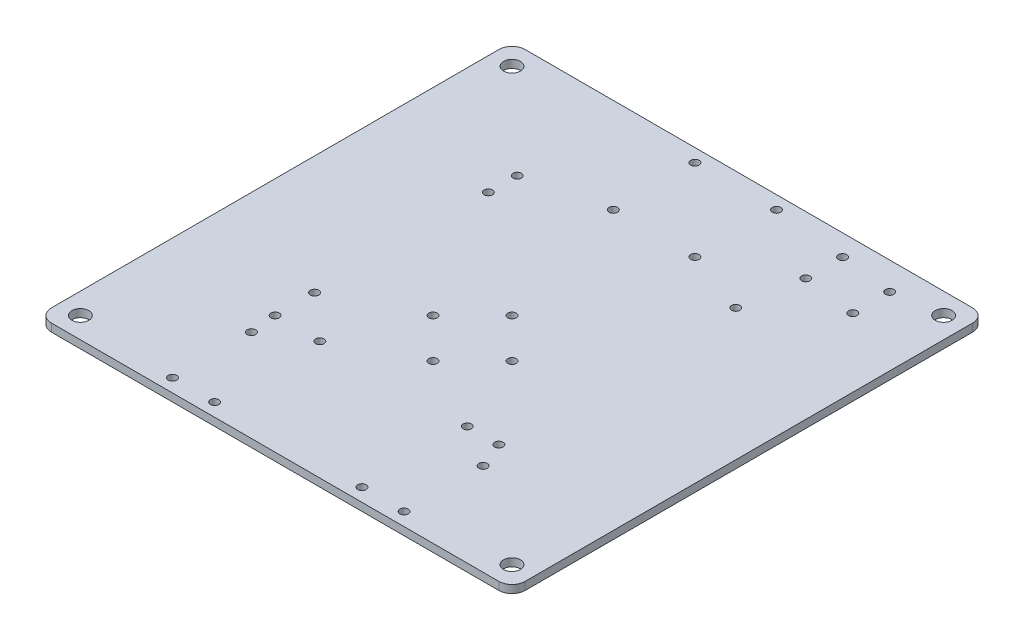
from build123d import *

# Parameters (mm, degrees)
SKETCH_1_R      = 3.2
SKETCH_1_R_2    = 1.6
EXTRUDE_1_DEPTH = 3


with BuildPart() as part:
    # 草图1 → 凸台-拉伸1 (new body)
    with BuildSketch(Plane(origin=(0, 0, 0), x_dir=(1, 0, 0), z_dir=(0, 1, 0))):
        with BuildLine():
            Line((5, 0), (175, 0))
            ThreePointArc((175, 0), (178.535533906, 1.464466094), (180, 5))
            Line((180, 5), (180, 175))
            ThreePointArc((180, 175), (178.535533906, 178.535533906), (175, 180))
            Line((175, 180), (5, 180))
            ThreePointArc((5, 180), (1.464466094, 178.535533906), (0, 175))
            Line((0, 175), (0, 5))
            ThreePointArc((0, 5), (1.464466094, 1.464466094), (5, 0))
        make_face()
        with Locations(Location((8, 172, 0), (0, 0, 270))):
            Circle(SKETCH_1_R, mode=Mode.SUBTRACT)
        with Locations(Location((172, 172, 0), (0, 0, 270))):
            Circle(SKETCH_1_R, mode=Mode.SUBTRACT)
        with Locations(Location((8, 8, 0), (0, 0, 270))):
            Circle(SKETCH_1_R, mode=Mode.SUBTRACT)
        with Locations(Location((172, 8, 0), (0, 0, 270))):
            Circle(SKETCH_1_R, mode=Mode.SUBTRACT)
        with Locations(Location((74.5, 175, 0), (0, 0, 270))):
            Circle(SKETCH_1_R_2, mode=Mode.SUBTRACT)
        with Locations(Location((74.5, 144, 0), (0, 0, 270))):
            Circle(SKETCH_1_R_2, mode=Mode.SUBTRACT)
        with Locations(Location((105.5, 144, 0), (0, 0, 90))):
            Circle(SKETCH_1_R_2, mode=Mode.SUBTRACT)
        with Locations(Location((105.5, 175, 0), (0, 0, 90))):
            Circle(SKETCH_1_R_2, mode=Mode.SUBTRACT)
        with Locations(Location((133.6, 172, 0), (0, 0, 270))):
            Circle(SKETCH_1_R_2, mode=Mode.SUBTRACT)
        with Locations(Location((133.6, 158, 0), (0, 0, 270))):
            Circle(SKETCH_1_R_2, mode=Mode.SUBTRACT)
        with Locations(Location((154, 169.5, 0), (0, 0, 270))):
            Circle(SKETCH_1_R_2, mode=Mode.SUBTRACT)
        with Locations(Location((154, 155.5, 0), (0, 0, 270))):
            Circle(SKETCH_1_R_2, mode=Mode.SUBTRACT)
        with Locations(Location((130, 135, 0), (0, 0, 270))):
            Circle(SKETCH_1_R_2, mode=Mode.SUBTRACT)
        with Locations(Location((130, 45, 0), (0, 0, 270))):
            Circle(SKETCH_1_R_2, mode=Mode.SUBTRACT)
        with Locations(Location((45, 137, 0), (0, 0, 270))):
            Circle(SKETCH_1_R_2, mode=Mode.SUBTRACT)
        with Locations(Location((45, 45, 0), (0, 0, 270))):
            Circle(SKETCH_1_R_2, mode=Mode.SUBTRACT)
        with Locations(Location((45, 126, 0), (0, 0, 270))):
            Circle(SKETCH_1_R_2, mode=Mode.SUBTRACT)
        with Locations(Location((45, 60, 0), (0, 0, 270))):
            Circle(SKETCH_1_R_2, mode=Mode.SUBTRACT)
        with Locations(Location((62, 45, 0), (0, 0, 270))):
            Circle(SKETCH_1_R_2, mode=Mode.SUBTRACT)
        with Locations(Location((62, 5, 0), (0, 0, 270))):
            Circle(SKETCH_1_R_2, mode=Mode.SUBTRACT)
        with Locations(Location((118, 45, 0), (0, 0, 270))):
            Circle(SKETCH_1_R_2, mode=Mode.SUBTRACT)
        with Locations(Location((118, 5, 0), (0, 0, 270))):
            Circle(SKETCH_1_R_2, mode=Mode.SUBTRACT)
        with Locations(Location((90, 90, 0), (0, 0, 270))):
            Circle(SKETCH_1_R_2, mode=Mode.SUBTRACT)
        with Locations(Location((90, 60, 0), (0, 0, 270))):
            Circle(SKETCH_1_R_2, mode=Mode.SUBTRACT)
        with Locations(Location((105, 75, 0), (0, 0, 270))):
            Circle(SKETCH_1_R_2, mode=Mode.SUBTRACT)
        with Locations(Location((75, 75, 0), (0, 0, 270))):
            Circle(SKETCH_1_R_2, mode=Mode.SUBTRACT)
        with Locations(Location((46, 5, 0), (0, 0, 270))):
            Circle(SKETCH_1_R_2, mode=Mode.SUBTRACT)
        with Locations(Location((46, 35, 0), (0, 0, 270))):
            Circle(SKETCH_1_R_2, mode=Mode.SUBTRACT)
        with Locations(Location((134, 35, 0), (0, 0, 270))):
            Circle(SKETCH_1_R_2, mode=Mode.SUBTRACT)
        with Locations(Location((134, 5, 0), (0, 0, 270))):
            Circle(SKETCH_1_R_2, mode=Mode.SUBTRACT)
    extrude(amount=EXTRUDE_1_DEPTH)


solid = part.part
